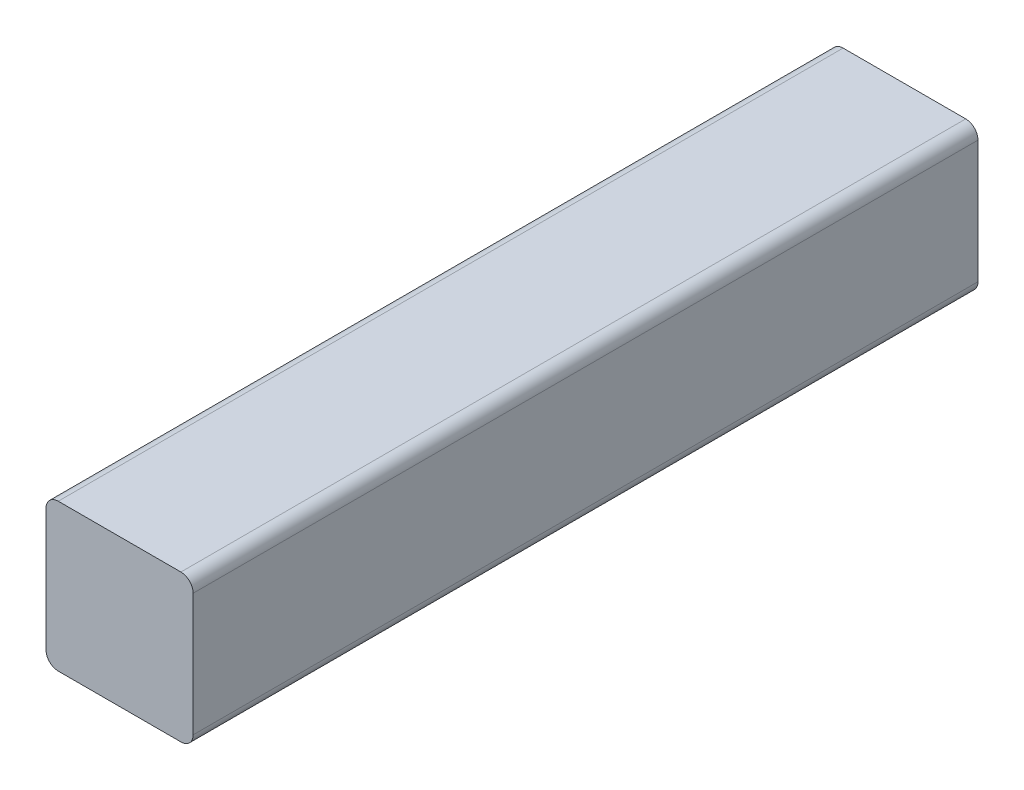
from build123d import *

# Parameters (mm, degrees)
SKETCH1_W           = 38.1
SKETCH1_H           = 38.1
BOSS_EXTRUDE1_DEPTH = 203.2
FILLET1_R           = 3.175


with BuildPart() as part:
    # Sketch1 → Boss-Extrude1 (new body)
    with BuildSketch(Plane.XY):
        Rectangle(SKETCH1_W, SKETCH1_H)
    extrude(amount=BOSS_EXTRUDE1_DEPTH)

    # Fillet1
    fillet1_edges = [part.edges().sort_by_distance(p)[0] for p in [
        (19.05, -19.05, 101.6),
        (-19.05, -19.05, 101.6),
        (-19.05, 19.05, 101.6),
        (19.05, 19.05, 101.6),
    ]]
    fillet(fillet1_edges, radius=FILLET1_R)


solid = part.part
